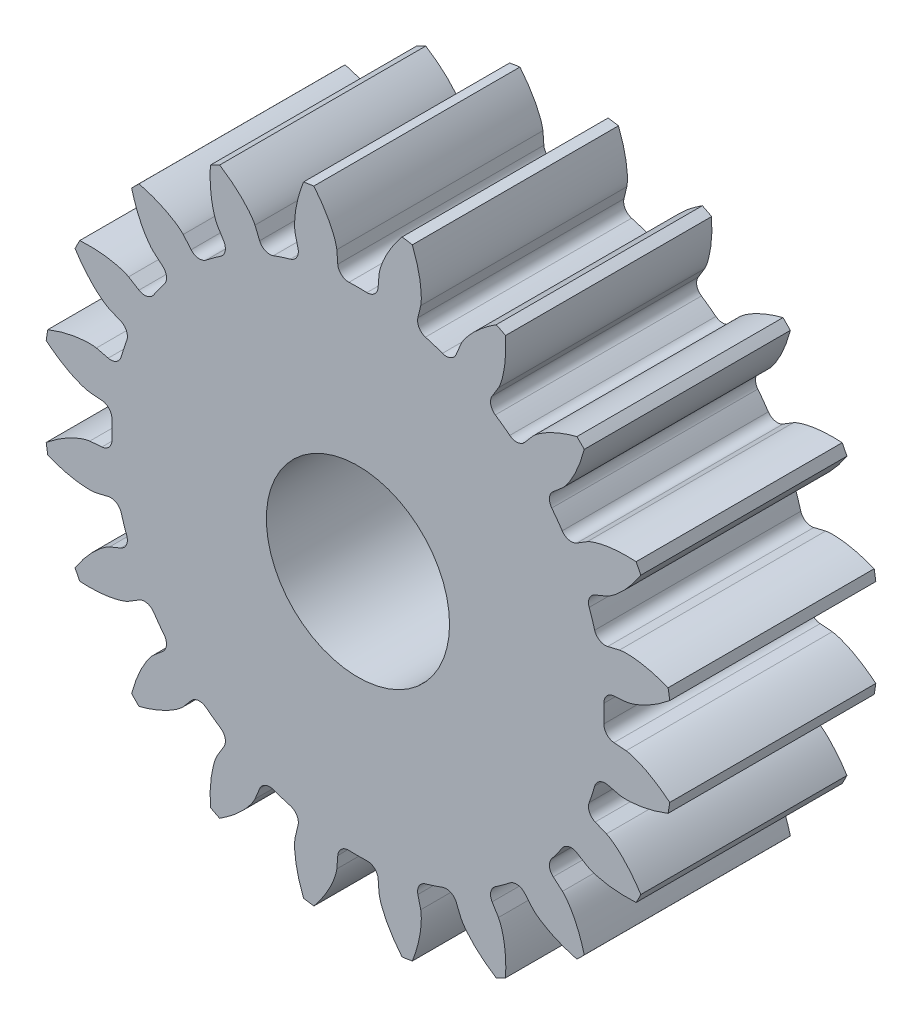
from build123d import *

# Parameters (mm, degrees)
BLANK_SKETCH_R    = 13.75
BLANK_DEPTH       = 9
TOOTH_SPACE_DEPTH = 22.427202337
TEETH_COUNT       = 20
BORE_DEPTH        = 22.253469727
BORE_DEPTH_BACK   = 22.253469727
BORE_SKETCH_R     = 4


with BuildPart() as part:
    # Blank Sketch → Blank (new body)
    with BuildSketch(Plane.XY):
        Circle(BLANK_SKETCH_R)
    extrude(amount=BLANK_DEPTH)

    # Tooth Space Sketch → Tooth Space (cut, symmetric)
    with BuildSketch(Plane.XY):
        with BuildLine():
            Line((11.709860103, 0.922712572), (11.180289267, 0.880983494))
            ThreePointArc((11.180289267, 0.880983494), (10.862988941, 0.723480031), (10.742915644, 0.39020951))
            ThreePointArc((10.742915644, 0.39020951), (10.75, 0), (10.742915644, -0.39020951))
            ThreePointArc((10.742915644, -0.39020951), (10.862988941, -0.723480031), (11.180289267, -0.880983494))
            Line((11.180289267, -0.880983494), (11.709860103, -0.922712572))
            add(Edge.make_bspline(
                [(11.709860103, -0.922712572), (11.715313475, -0.923234617), (11.730580069, -0.924982426), (11.759319753, -0.929405731), (11.80598663, -0.938205714), (11.86506971, -0.951736167), (11.94092317, -0.971871237), (12.029548412, -0.998976801), (12.126085986, -1.032288866), (12.230093072, -1.072304199), (12.332879138, -1.115538905), (12.434437251, -1.161726096), (12.534681177, -1.210479105), (12.654945734, -1.272744636), (12.797491556, -1.351852601), (12.961497116, -1.450701421), (13.144282968, -1.570278326), (13.326873882, -1.699980424), (13.503420438, -1.834000155), (13.677968733, -1.976594979), (13.844122091, -2.119647646), (14.012499078, -2.275384766), (14.16579995, -2.422795632), (14.332640843, -2.595647481), (14.46587003, -2.737409714), (14.599233693, -2.890118061), (14.663505795, -2.96535919), (14.69608147, -3.004195304)],
                knots=[0, 0, 0, 0, 0, 0.005376749, 0.015083688, 0.02853182, 0.046610139, 0.064854849, 0.092110525, 0.119476176, 0.146842496, 0.174208854, 0.201574956, 0.228941013, 0.256307345, 0.307035032, 0.361767352, 0.41649966, 0.471231936, 0.525964282, 0.580696615, 0.635428982, 0.690161387, 0.744893688, 0.799626082, 0.854358408, 0.909090915, 0.909090915, 0.909090915, 0.909090915, 0.909090915], degree=4))
            Line((14.69608147, -3.004195304), (14.69608147, 3.004195304))
            add(Edge.make_bspline(
                [(11.709860103, 0.922712572), (11.715313475, 0.923234617), (11.730580069, 0.924982426), (11.759319753, 0.929405731), (11.80598663, 0.938205714), (11.86506971, 0.951736167), (11.94092317, 0.971871237), (12.029548412, 0.998976801), (12.126085986, 1.032288866), (12.230093072, 1.072304199), (12.332879138, 1.115538905), (12.434437251, 1.161726096), (12.534681177, 1.210479105), (12.654945734, 1.272744636), (12.797491556, 1.351852601), (12.961497116, 1.450701421), (13.144282968, 1.570278326), (13.326873882, 1.699980424), (13.503420438, 1.834000155), (13.677968733, 1.976594979), (13.844122091, 2.119647646), (14.012499078, 2.275384766), (14.16579995, 2.422795632), (14.332640843, 2.595647481), (14.46587003, 2.737409714), (14.599233693, 2.890118061), (14.663505795, 2.96535919), (14.69608147, 3.004195304)],
                knots=[0, 0, 0, 0, 0, 0.005376749, 0.015083688, 0.02853182, 0.046610139, 0.064854849, 0.092110525, 0.119476176, 0.146842496, 0.174208854, 0.201574956, 0.228941013, 0.256307345, 0.307035032, 0.361767352, 0.41649966, 0.471231936, 0.525964282, 0.580696615, 0.635428982, 0.690161387, 0.744893688, 0.799626082, 0.854358408, 0.909090915, 0.909090915, 0.909090915, 0.909090915, 0.909090915], degree=4))
        make_face()
    tooth_space = extrude(amount=TOOTH_SPACE_DEPTH, both=True, mode=Mode.SUBTRACT)

    # Teeth: Tooth Space ×20 about axis
    teeth_axis = Axis((0, 0, -0.45007105), (0, 0, 1))
    for i in range(1, TEETH_COUNT):
        add(tooth_space.rotate(teeth_axis, i * 360 / TEETH_COUNT), mode=Mode.SUBTRACT)

    # Bore Sketch → Bore (cut, two sides: drawn at the far end of the back side and taken through both)
    with BuildSketch(Plane.XY.offset(-BORE_DEPTH_BACK)):
        Circle(BORE_SKETCH_R)
    extrude(amount=BORE_DEPTH + BORE_DEPTH_BACK, mode=Mode.SUBTRACT)


solid = part.part
